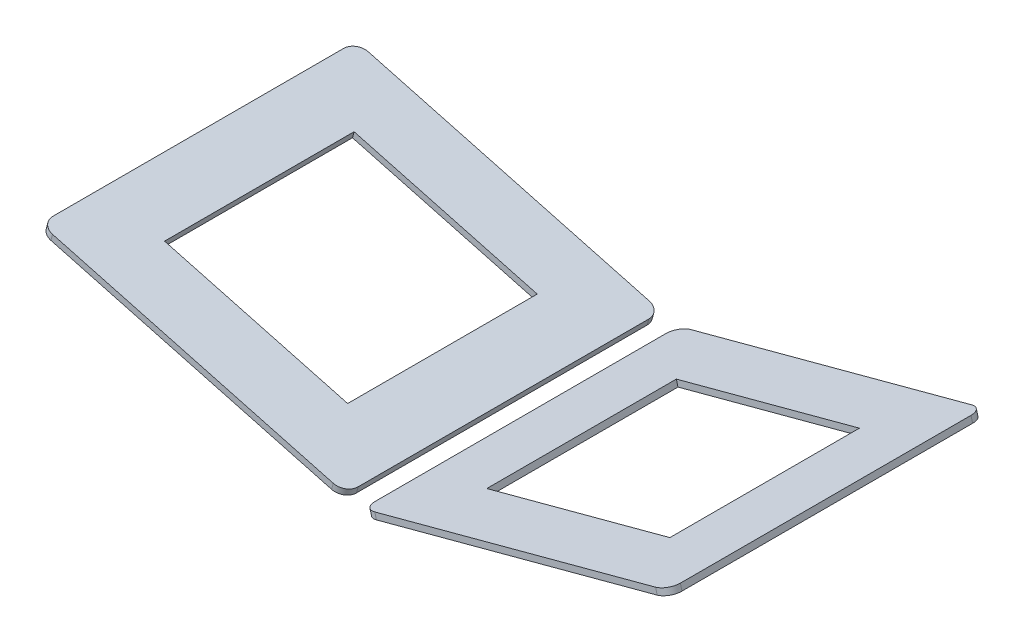
from build123d import *

# Parameters (mm, degrees)
SKETCH_1_W               = 30
SKETCH_1_H               = 30
EXTRUDE_1_DEPTH          = 1
MOVE_BODY_1_ANGLE        = 15
PATTERN_CIRCULAR_1_COUNT = 2


with BuildPart() as part:
    # 草图1 → 凸台-拉伸1 (new body)
    with BuildSketch(Plane(origin=(0, 0, 0), x_dir=(1, 0, 0), z_dir=(0, 1, 0))):
        with BuildLine():
            Line((-50, 25.321543408), (-4, 25.321543408))
            ThreePointArc((-4, 25.321543408), (-2.585786438, 24.735756971), (-2, 23.321543408))
            Line((-2, 23.321543408), (-2, -22.678456592))
            ThreePointArc((-2, -22.678456592), (-2.585786438, -24.092670154), (-4, -24.678456592))
            Line((-4, -24.678456592), (-50, -24.678456592))
            ThreePointArc((-50, -24.678456592), (-51.414213562, -24.092670154), (-52, -22.678456592))
            Line((-52, -22.678456592), (-52, 23.321543408))
            ThreePointArc((-52, 23.321543408), (-51.414213562, 24.735756971), (-50, 25.321543408))
        make_face()
        with Locations((-27, 0.321543408)):
            Rectangle(SKETCH_1_W, SKETCH_1_H, mode=Mode.SUBTRACT)
    extrude(amount=EXTRUDE_1_DEPTH)


with BuildPart() as part_1:
    # Move Body 1: moved
    add(part.part.rotate(Axis((0, 0, 0), (0, 0, -1)), MOVE_BODY_1_ANGLE))


with BuildPart() as pattern_circular_1_1:
    # 阵列(圆周)1: pattern copy
    add(part_1.part.rotate(Axis((0, 0, 0), (0, 1, 0)), 1 * 360 / PATTERN_CIRCULAR_1_COUNT))


solid = Compound([part_1.part, pattern_circular_1_1.part])
